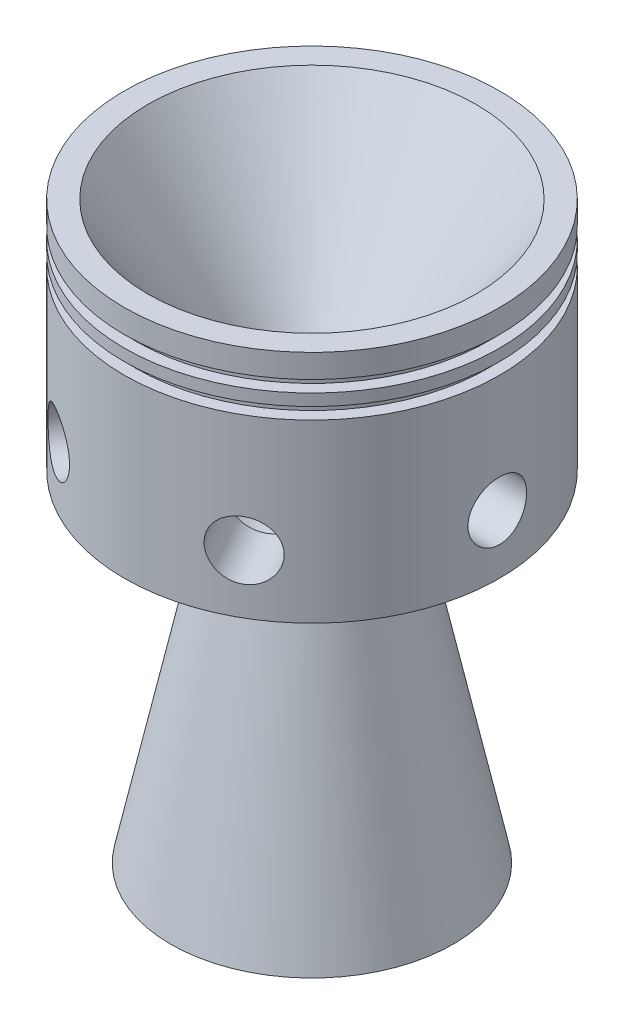
from build123d import *

# Parameters (mm, degrees)
RADIAL_BOLTS_COUNT = 6


with BuildPart() as part:
    # Sketch1 → base_revolve (revolve)
    with BuildSketch(Plane.XY, mode=Mode.PRIVATE) as base_revolve_sk:
        Polygon((0, 0), (2.54, 0), (16.129, -19.407103264), (16.129, -21.947103264), (7.566605976, -62.23), (5.026605976, -62.23), (12.855064142, -25.4), (0, -25.4), (0, -6.35), (1.27, -6.35), (1.27, -5.08), (0, -5.08), (0, -3.81), (1.27, -3.81), (1.27, -2.54), (0, -2.54), align=None)
    revolve(base_revolve_sk.sketch.rotate(Axis((20.32, 0, 0), (0, -1, 0)), 270), axis=Axis((20.32, 0, 0), (0, -1, 0)))

    # Sketch3 → 1/4 (0.25) Diameter Hole1 (revolve, cut)
    with BuildSketch(Plane(origin=(40.64, -19.05, 0), x_dir=(0, 0, -1), z_dir=(0, 1, 0))):
        Polygon((0, 0), (0, 8.89), (3.175, 6.982267535), (3.175, 0), align=None)
    f_1_4_0_25_diameter_hole1 = revolve(axis=Axis((46.99, -19.05, 0), (-1, 0, 0)), mode=Mode.SUBTRACT)

    # radial_bolts: 1/4 (0.25) Diameter Hole1 ×6 about axis
    radial_bolts_axis = Axis((20.32, 0, 0), (0, 1, 0))
    for i in range(1, RADIAL_BOLTS_COUNT):
        add(f_1_4_0_25_diameter_hole1.rotate(radial_bolts_axis, i * 360 / RADIAL_BOLTS_COUNT), mode=Mode.SUBTRACT)


solid = part.part
